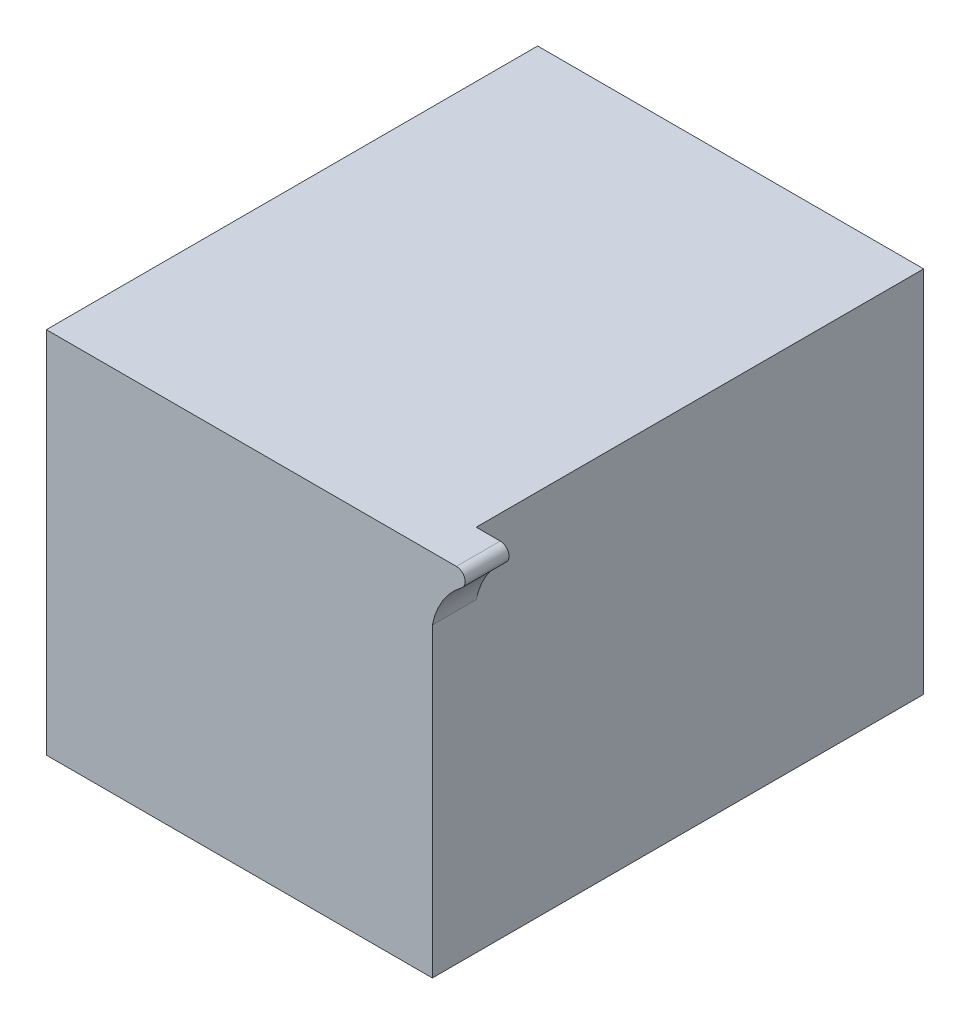
from build123d import *

# Parameters (mm, degrees)
SKETCH1_W           = 44
SKETCH1_H           = 42
BOSS_EXTRUDE1_DEPTH = 56
BOSS_EXTRUDE2_DEPTH = 5
FILLET1_R           = 1


with BuildPart() as part:
    # Sketch1 → Boss-Extrude1 (new body)
    with BuildSketch(Plane.XY):
        with Locations((22, 21)):
            Rectangle(SKETCH1_W, SKETCH1_H)
    extrude(amount=-BOSS_EXTRUDE1_DEPTH)

    # Sketch2 → Boss-Extrude2 (add)
    with BuildSketch(Plane.XY):
        with BuildLine():
            Line((44, 42), (52.691651223, 42))
            ThreePointArc((52.691651223, 42), (47.065035319, 39.983558931), (44, 34.852243348))
            Line((44, 34.852243348), (44, 42))
        make_face()
    extrude(amount=-BOSS_EXTRUDE2_DEPTH)

    # Fillet1
    fillet1_edges = [part.edges().sort_by_distance(p)[0] for p in [
        (52.691651223, 42, -2.5),
    ]]
    fillet(fillet1_edges, radius=FILLET1_R)


solid = part.part
